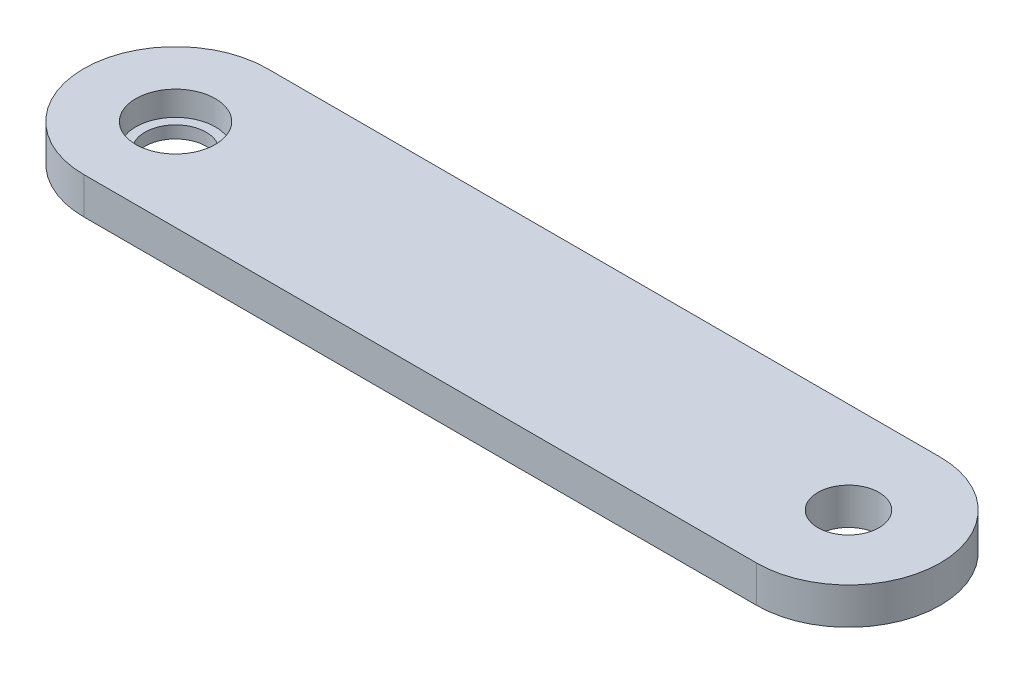
from build123d import *

# Parameters (mm, degrees)
SKETCH2_R           = 5
BOSS_EXTRUDE1_DEPTH = 6
SKETCH3_R           = 6.5
CUT_EXTRUDE1_DEPTH  = 4


with BuildPart() as part:
    # Sketch2 → Boss-Extrude1 (new body)
    with BuildSketch(Plane(origin=(0, 0, 0), x_dir=(1, 0, 0), z_dir=(0, 1, 0))):
        with BuildLine():
            Line((-45, 15), (65, 15))
            ThreePointArc((65, 15), (80, 0), (65, -15))
            Line((65, -15), (-45, -15))
            ThreePointArc((-45, -15), (-60, 0), (-45, 15))
        make_face()
        with Locations(Location((-45, 0, 0), (0, 0, 270))):
            Circle(SKETCH2_R, mode=Mode.SUBTRACT)
        with Locations(Location((65, 0, 0), (0, 0, 270))):
            Circle(SKETCH2_R, mode=Mode.SUBTRACT)
    extrude(amount=BOSS_EXTRUDE1_DEPTH)

    # Sketch3 → Cut-Extrude1 (cut)
    with BuildSketch(Plane(origin=(0, 6, 0), x_dir=(1, 0, 0), z_dir=(0, 1, 0))):
        with Locations(Location((-45, 0, 0), (0, 0, 270))):
            Circle(SKETCH3_R)
    extrude(amount=-CUT_EXTRUDE1_DEPTH, mode=Mode.SUBTRACT)


solid = part.part
